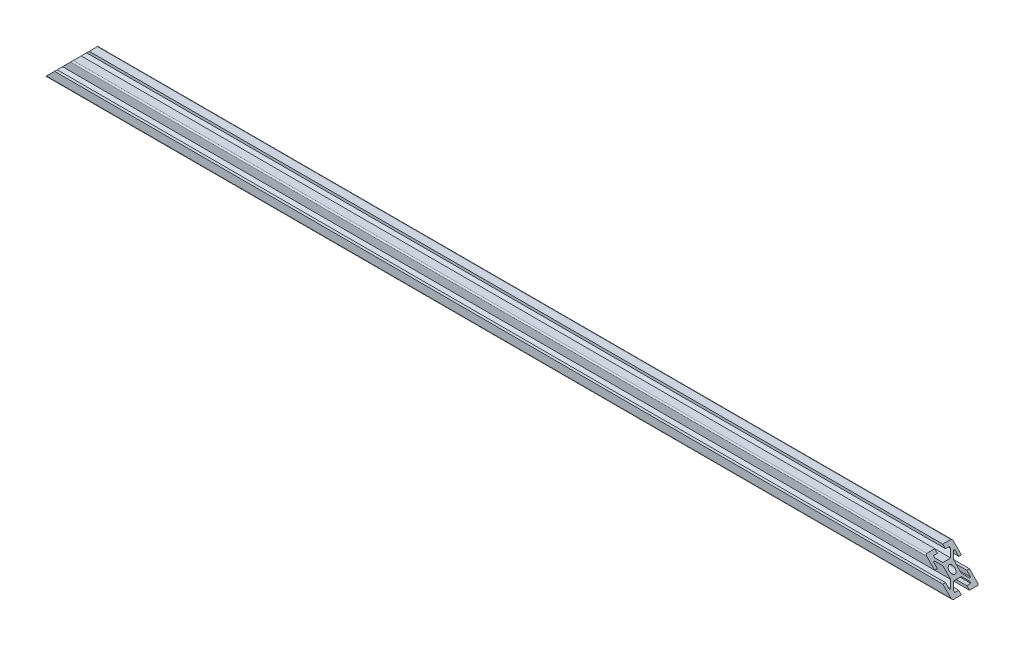
from build123d import *

# Parameters (mm, degrees)
SKETCH1_R           = 2.1
BOSS_EXTRUDE1_DEPTH = 680
CUT_EXTRUDE5_DEPTH  = 10
CUT_EXTRUDE6_DEPTH  = 10


with BuildPart() as part:
    # Sketch1 → Boss-Extrude1 (new body)
    with BuildSketch(Plane(origin=(0, 0, 0), x_dir=(0, 0, -1), z_dir=(1, 0, 0))):
        with BuildLine():
            Line((-10, 9), (-10, 3))
            Line((-10, 3), (-8, 3))
            Line((-8, 3), (-8, 6))
            Line((-8, 6), (-7.060660172, 6))
            Line((-7.060660172, 6), (-4, 2.939339828))
            Line((-4, 2.939339828), (-4, -2.939339828))
            Line((-4, -2.939339828), (-7.060660172, -6))
            Line((-7.060660172, -6), (-8, -6))
            Line((-8, -6), (-8, -3))
            Line((-8, -3), (-10, -3))
            Line((-10, -3), (-10, -9))
            ThreePointArc((-10, -9), (-9.707106781, -9.707106781), (-9, -10))
            Line((-9, -10), (-3, -10))
            Line((-3, -10), (-3, -8))
            Line((-3, -8), (-6, -8))
            Line((-6, -8), (-6, -7.060660172))
            Line((-6, -7.060660172), (-2.939339828, -4))
            Line((-2.939339828, -4), (2.939339828, -4))
            Line((2.939339828, -4), (6, -7.060660172))
            Line((6, -7.060660172), (6, -8))
            Line((6, -8), (3, -8))
            Line((3, -8), (3, -10))
            Line((3, -10), (9, -10))
            ThreePointArc((9, -10), (9.707106781, -9.707106781), (10, -9))
            Line((10, -9), (10, -3))
            Line((10, -3), (8, -3))
            Line((8, -3), (8, -6))
            Line((8, -6), (7.060660172, -6))
            Line((7.060660172, -6), (4, -2.939339828))
            Line((4, -2.939339828), (4, 2.939339828))
            Line((4, 2.939339828), (7.060660172, 6))
            Line((7.060660172, 6), (8, 6))
            Line((8, 6), (8, 3))
            Line((8, 3), (10, 3))
            Line((10, 3), (10, 9))
            ThreePointArc((10, 9), (9.707106781, 9.707106781), (9, 10))
            Line((9, 10), (3, 10))
            Line((3, 10), (3, 8))
            Line((3, 8), (6, 8))
            Line((6, 8), (6, 7.060660172))
            Line((6, 7.060660172), (2.939339828, 4))
            Line((2.939339828, 4), (-2.939339828, 4))
            Line((-2.939339828, 4), (-6, 7.060660172))
            Line((-6, 7.060660172), (-6, 8))
            Line((-6, 8), (-3, 8))
            Line((-3, 8), (-3, 10))
            Line((-3, 10), (-9, 10))
            ThreePointArc((-9, 10), (-9.707106781, 9.707106781), (-10, 9))
        make_face()
        Circle(SKETCH1_R, mode=Mode.SUBTRACT)
    extrude(amount=BOSS_EXTRUDE1_DEPTH)

    # Sketch32 → Cut-Extrude5 (cut, symmetric)
    with BuildSketch(Plane.XY):
        Polygon((0, 10), (20, 10), (0, -10), align=None)
    extrude(amount=CUT_EXTRUDE5_DEPTH, both=True, mode=Mode.SUBTRACT)

    # Sketch33 → Cut-Extrude6 (cut, symmetric)
    with BuildSketch(Plane.XY):
        Polygon((660, 10), (680, 10), (680, -10), align=None)
    extrude(amount=CUT_EXTRUDE6_DEPTH, both=True, mode=Mode.SUBTRACT)


solid = part.part
